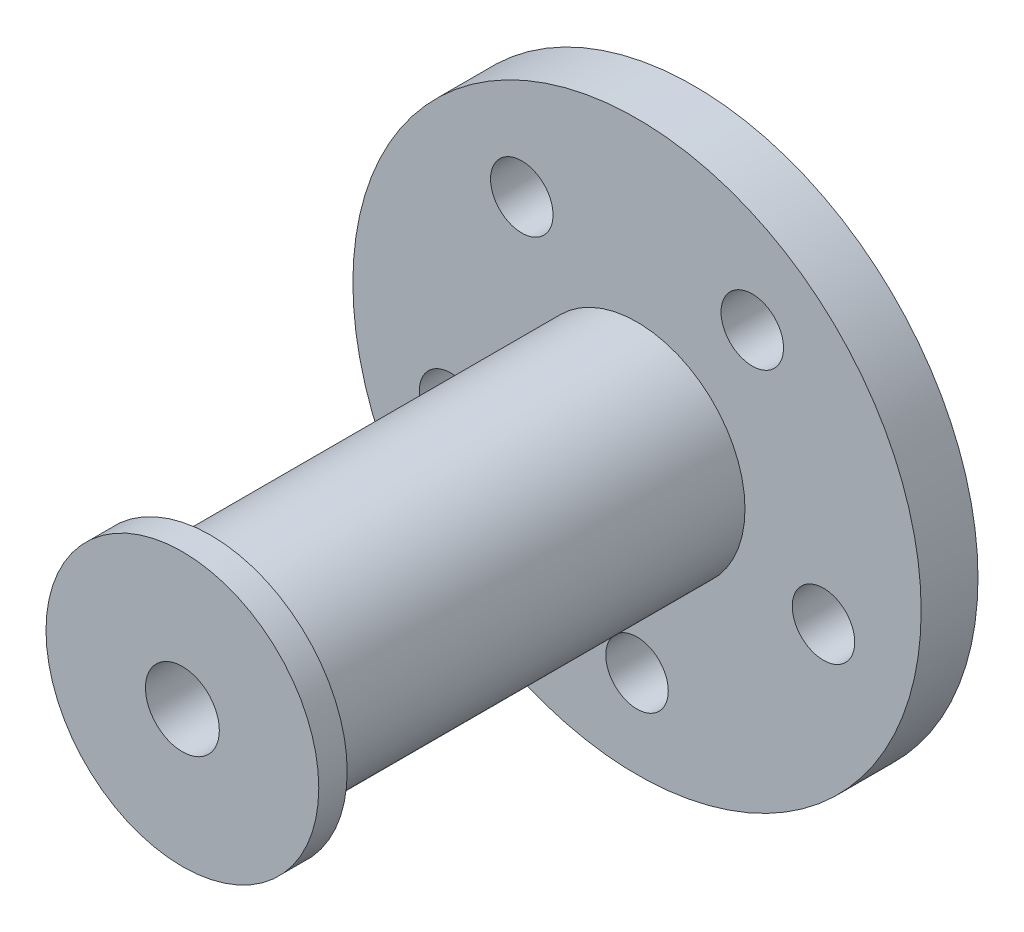
from build123d import *

# Parameters (mm, degrees)
SKETCH1_R           = 31.75
BOSS_EXTRUDE1_DEPTH = 6.35
SKETCH2_R           = 12.065
BOSS_EXTRUDE2_DEPTH = 50.8
BOSS_EXTRUDE3_START = -3.175
SKETCH4_R           = 15.24
SKETCH4_R_2         = 12.065
BOSS_EXTRUDE3_DEPTH = 3.175
SKETCH5_R           = 3.4925
CUT_EXTRUDE1_DEPTH  = 68.7994469
CIRPATTERN1_COUNT   = 5
SKETCH6_R           = 3.048
CUT_EXTRUDE2_DEPTH  = 73.679071953
SKETCH6_3_R         = 4.1275
SKETCH6_3_R_2       = 3.048
CUT_EXTRUDE3_DEPTH  = 55.499


with BuildPart() as part:
    # Sketch1 → Boss-Extrude1 (new body)
    with BuildSketch(Plane.XY):
        Circle(SKETCH1_R)
    extrude(amount=BOSS_EXTRUDE1_DEPTH)

    # Sketch2 → Boss-Extrude2 (add)
    with BuildSketch(Plane.XY.offset(6.35)):
        Circle(SKETCH2_R)
    extrude(amount=BOSS_EXTRUDE2_DEPTH)

    # Sketch4 → Boss-Extrude3 (add)
    with BuildSketch(Plane.XY.offset(57.15).offset(BOSS_EXTRUDE3_START)):
        Circle(SKETCH4_R)
        Circle(SKETCH4_R_2, mode=Mode.SUBTRACT)
    extrude(amount=BOSS_EXTRUDE3_DEPTH)

    # Sketch5 → Cut-Extrude1 (cut, through all)
    with BuildSketch(Plane.XY.offset(6.35)):
        with Locations((0, -21.9075)):
            Circle(SKETCH5_R)
    cut_extrude1 = extrude(amount=-CUT_EXTRUDE1_DEPTH, mode=Mode.SUBTRACT)

    # CirPattern1: Cut-Extrude1 ×5 about axis
    cirpattern1_axis = Axis((0, 0, 6.35), (0, 0, 1))
    for i in range(1, CIRPATTERN1_COUNT):
        add(cut_extrude1.rotate(cirpattern1_axis, i * 360 / CIRPATTERN1_COUNT), mode=Mode.SUBTRACT)

    # Sketch6 → Cut-Extrude2 (cut, through all)
    with BuildSketch(Plane.XY.offset(57.15)):
        Circle(SKETCH6_R)
    extrude(amount=-CUT_EXTRUDE2_DEPTH, mode=Mode.SUBTRACT)

    # Sketch6<3> → Cut-Extrude3 (cut)
    with BuildSketch(Plane.XY.offset(57.15)):
        Circle(SKETCH6_3_R)
        Circle(SKETCH6_3_R_2, mode=Mode.SUBTRACT)
    extrude(amount=-CUT_EXTRUDE3_DEPTH, mode=Mode.SUBTRACT)


solid = part.part
